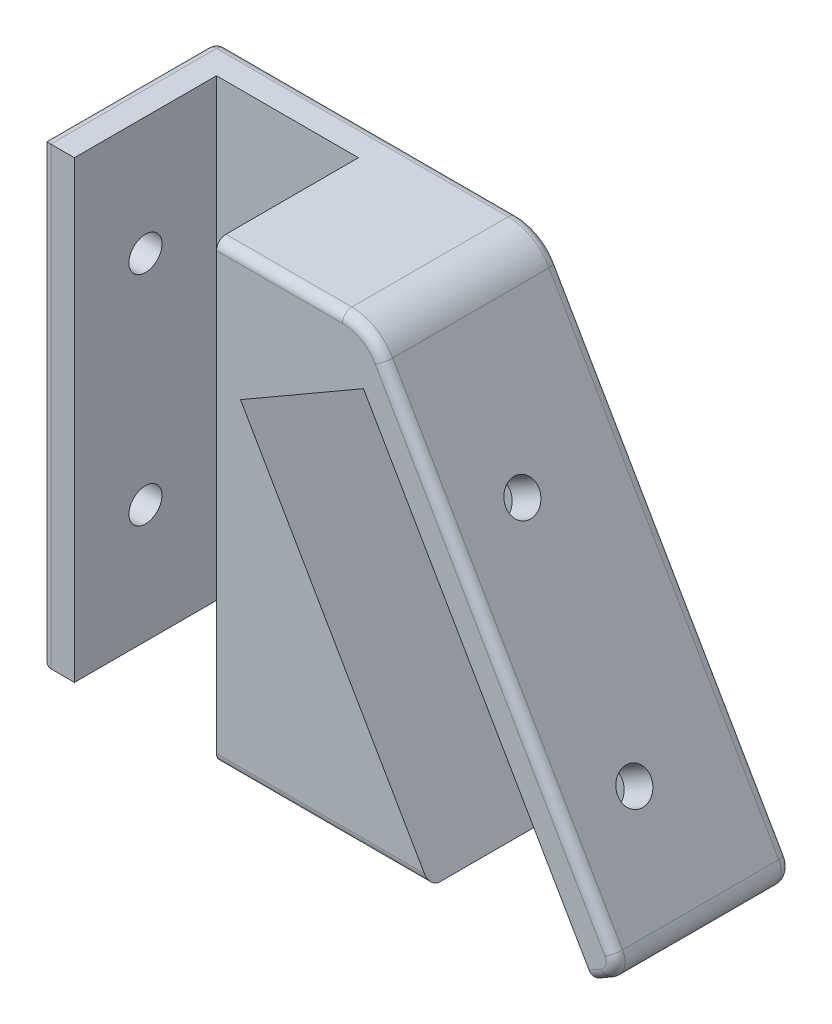
from build123d import *

# Parameters (mm, degrees)
BOSS_EXTRUDE1_DEPTH = 18.5
SKETCH2_W           = 15
SKETCH2_H           = 48
CUT_EXTRUDE1_DEPTH  = 15
SKETCH3_R           = 1.75
CUT_EXTRUDE2_DEPTH  = 3.5
SKETCH4_R           = 1.75
CUT_EXTRUDE3_DEPTH  = 4
SKETCH5_R           = 1.75
CUT_EXTRUDE4_DEPTH  = 4
CUT_EXTRUDE5_DEPTH  = 19
FILLET1_R           = 2
FILLET2_R           = 5
FILLET3_R           = 1


with BuildPart() as part:
    # Sketch1 → Boss-Extrude1 (new body)
    with BuildSketch(Plane.XY):
        Polygon((20.545588903, 15.488794989), (48.258401824, -32.511205011), (7.85498998, -32.511205011), (-14.14501002, -32.511205011), (-14.14501002, 15.488794989), align=None)
    extrude(amount=BOSS_EXTRUDE1_DEPTH)

    # Sketch2 → Cut-Extrude1 (cut)
    with BuildSketch(Plane.XY.offset(18.5)):
        with Locations((-3.14501002, -8.511205011)):
            Rectangle(SKETCH2_W, SKETCH2_H)
        Polygon((44.21694994, -32.511205011), (19.886822921, 9.62981114), (6.896441864, 2.12981114), (26.896441864, -32.511205011), align=None)
    extrude(amount=-CUT_EXTRUDE1_DEPTH, mode=Mode.SUBTRACT)

    # Sketch3 → Cut-Extrude2 (cut)
    with BuildSketch(Plane(origin=(22.116036645, 12.76869971, 0), x_dir=(0, 0, -1), z_dir=(0.8660254037844377, 0.5000000000000014, 0))):
        with Locations(Location((-11, -37.764004417, 0), (0, 0, 90))):
            Circle(SKETCH3_R)
        with Locations(Location((-11, -14.103750379, 0), (0, 0, 90))):
            Circle(SKETCH3_R)
    extrude(amount=-CUT_EXTRUDE2_DEPTH, mode=Mode.SUBTRACT)

    # Sketch4 → Cut-Extrude3 (cut)
    with BuildSketch(Plane(origin=(0, 0, 0), x_dir=(-1, 0, 0), z_dir=(0, 0, -1))):
        with Locations((-29.306695902, -21.685887464)):
            Circle(SKETCH4_R)
        with Locations((-19.641632393, -4.945506407)):
            Circle(SKETCH4_R)
        with Locations((3.14501002, 2.988794989)):
            Circle(SKETCH4_R)
        with Locations((3.14501002, -20.011205011)):
            Circle(SKETCH4_R)
    extrude(amount=-CUT_EXTRUDE3_DEPTH, mode=Mode.SUBTRACT)

    # Sketch5 → Cut-Extrude4 (cut)
    with BuildSketch(Plane.ZY.offset(14.14501002)):
        with Locations(Location((11, -20.011205011, 0), (0, 0, 270))):
            Circle(SKETCH5_R)
        with Locations(Location((11, 2.988794989, 0), (0, 0, 270))):
            Circle(SKETCH5_R)
    extrude(amount=-CUT_EXTRUDE4_DEPTH, mode=Mode.SUBTRACT)

    # Sketch6 → Cut-Extrude5 (cut)
    with BuildSketch(Plane.XY.offset(18.5)):
        Polygon((44.21694994, -32.511205011), (47.248038853, -30.761205011), (48.258401824, -32.511205011), align=None)
    extrude(amount=-CUT_EXTRUDE5_DEPTH, mode=Mode.SUBTRACT)

    # Fillet1
    fillet1_edges = [part.edges().sort_by_distance(p)[0] for p in [
        (47.248038853, -30.761205011, 9.25),
    ]]
    fillet(fillet1_edges, radius=FILLET1_R)

    # Fillet2
    fillet2_edges = [part.edges().sort_by_distance(p)[0] for p in [
        (20.545588903, 15.488794989, 9.25),
    ]]
    fillet(fillet2_edges, radius=FILLET2_R)

    # Fillet3
    fillet3_edges = [part.edges().sort_by_distance(p)[0] for p in [
        (44.866468993, -32.136205011, 18.5),
        (46.447839698, -30.546792294, 18.5),
        (34.118501715, -8.020179607, 18.5),
        (20.158837557, 14.818922008, 18.5),
        (44.866468993, -32.136205011, 0),
        (46.447839698, -30.546792294, 0),
        (34.118501715, -8.020179607, 0),
        (20.158837557, 14.818922008, 0),
        (15.625715922, -32.511205011, 18.5),
        (11.006913769, 15.488794989, 18.5),
        (-14.14501002, -32.511205011, 9.25),
        (-14.14501002, 15.488794989, 9.25),
        (-14.14501002, -8.511205011, 18.5),
        (15.03596996, -32.511205011, 0),
        (1.756913769, 15.488794989, 0),
        (-14.14501002, -8.511205011, 0),
    ]]
    fillet(fillet3_edges, radius=FILLET3_R)


solid = part.part
